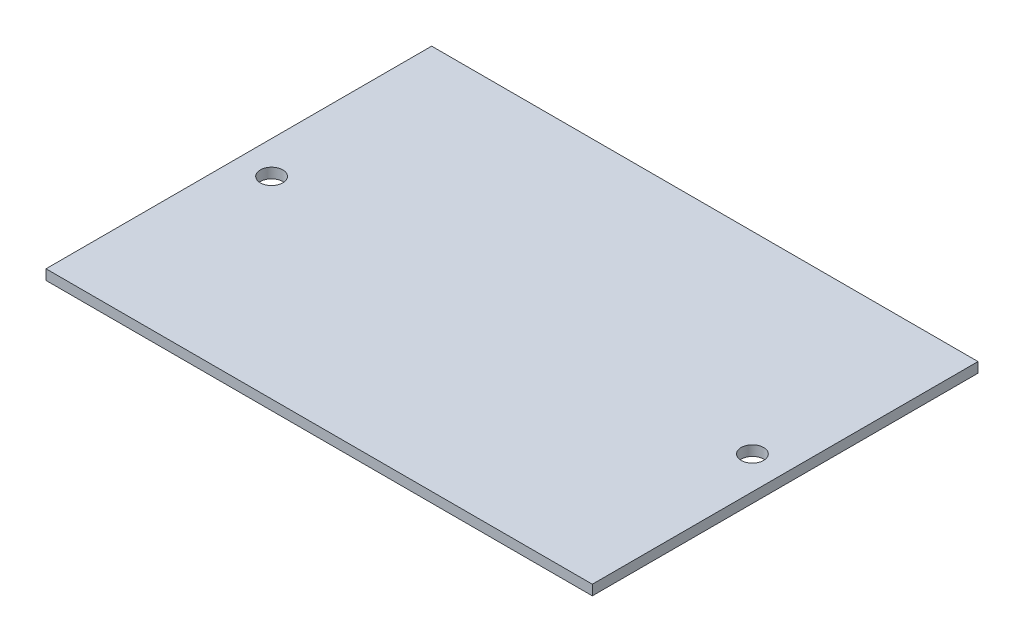
from build123d import *

# Parameters (mm, degrees)
SKETCH1_W           = 86.36
SKETCH1_H           = 60.96
BOSS_EXTRUDE1_DEPTH = 1.6
CUT_EXTRUDE1_REACH  = 54.878
SKETCH2_R           = 1.778


with BuildPart() as part:
    # Sketch1 → Boss-Extrude1 (new body)
    with BuildSketch(Plane(origin=(0, 0, 0), x_dir=(1, 0, 0), z_dir=(0, 1, 0))):
        Rectangle(SKETCH1_W, SKETCH1_H)
    extrude(amount=BOSS_EXTRUDE1_DEPTH)

    # Sketch2 → Cut-Extrude1 (cut, up to next)
    with BuildSketch(Plane(origin=(0, 1.6, 0), x_dir=(1, 0, 0), z_dir=(0, 1, 0)), mode=Mode.PRIVATE) as cut_extrude1_sk1:
        with Locations(Location((-38, 0, 0), (0, 0, 270))):
            Circle(SKETCH2_R)
    cut_extrude1_tool1 = extrude(cut_extrude1_sk1.sketch, amount=-CUT_EXTRUDE1_REACH, mode=Mode.PRIVATE) & part.part
    # Sketch2 → Cut-Extrude1 (cut, up to next)
    with BuildSketch(Plane(origin=(0, 1.6, 0), x_dir=(1, 0, 0), z_dir=(0, 1, 0)), mode=Mode.PRIVATE) as cut_extrude1_sk2:
        with Locations(Location((38, 0, 0), (0, 0, 270))):
            Circle(SKETCH2_R)
    cut_extrude1_tool2 = extrude(cut_extrude1_sk2.sketch, amount=-CUT_EXTRUDE1_REACH, mode=Mode.PRIVATE) & part.part
    add(cut_extrude1_tool1.solids().sort_by_distance((-38, 1.6, 0))[0], mode=Mode.SUBTRACT)
    add(cut_extrude1_tool2.solids().sort_by_distance((38, 1.6, 0))[0], mode=Mode.SUBTRACT)


solid = part.part
